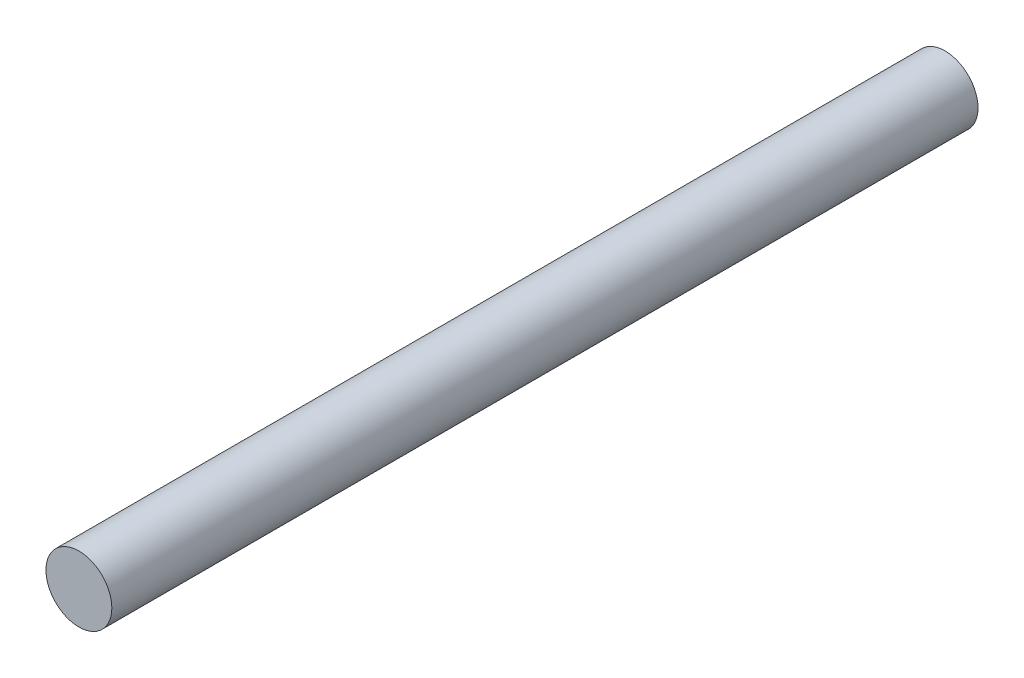
from build123d import *

# Parameters (mm, degrees)
ESBO_O1_R                = 1.75
RESSALTO_EXTRUS_O1_DEPTH = 46


with BuildPart() as part:
    # Esboço1 → Ressalto-extrusão1 (new body)
    with BuildSketch(Plane.XY):
        Circle(ESBO_O1_R)
    extrude(amount=RESSALTO_EXTRUS_O1_DEPTH)


solid = part.part
